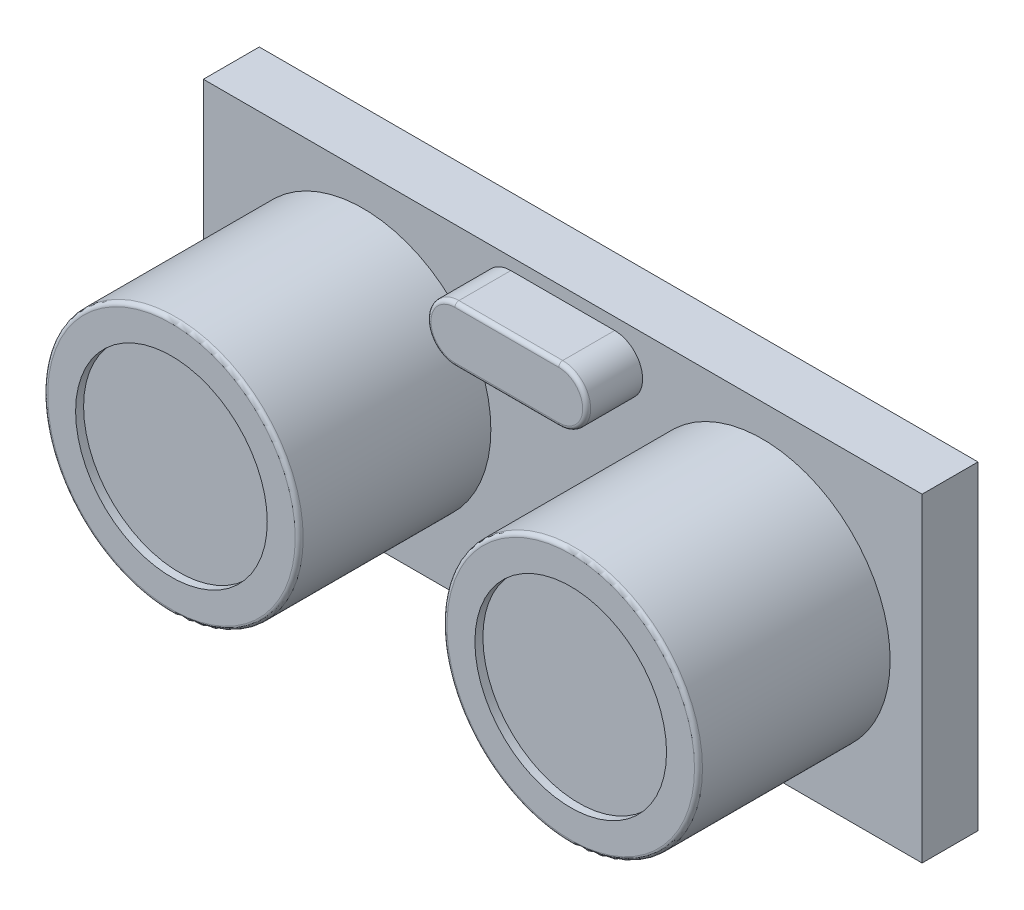
from build123d import *

# Parameters (mm, degrees)
SKETCH1_W           = 45
SKETCH1_H           = 20
BOSS_EXTRUDE1_DEPTH = 3.5
SKETCH2_R           = 8
BOSS_EXTRUDE2_DEPTH = 12
SKETCH3_R           = 6
CUT_EXTRUDE1_DEPTH  = 0.5
FILLET1_R           = 0.25
BOSS_EXTRUDE3_DEPTH = 3.5
FILLET2_R           = 0.25


with BuildPart() as part:
    # Sketch1 → Boss-Extrude1 (new body)
    with BuildSketch(Plane.XY):
        Rectangle(SKETCH1_W, SKETCH1_H)
    extrude(amount=BOSS_EXTRUDE1_DEPTH)

    # Sketch2 → Boss-Extrude2 (add)
    with BuildSketch(Plane.XY.offset(3.5)):
        with Locations((12.5, 0)):
            Circle(SKETCH2_R)
        with Locations((-12.5, 0)):
            Circle(SKETCH2_R)
    extrude(amount=BOSS_EXTRUDE2_DEPTH)

    # Sketch3 → Cut-Extrude1 (cut)
    with BuildSketch(Plane.XY.offset(15.5)):
        with Locations((-12.5, 0)):
            Circle(SKETCH3_R)
        with Locations((12.5, 0)):
            Circle(SKETCH3_R)
    extrude(amount=-CUT_EXTRUDE1_DEPTH, mode=Mode.SUBTRACT)

    # Fillet1
    fillet1_edges = [part.edges().sort_by_distance(p)[0] for p in [
        (4.5, 0, 15.5),
        (-20.5, 0, 15.5),
    ]]
    fillet(fillet1_edges, radius=FILLET1_R)

    # Sketch4 → Boss-Extrude3 (add)
    with BuildSketch(Plane.XY.offset(3.5)):
        with BuildLine():
            Line((-3.25, 9.25), (3.25, 9.25))
            ThreePointArc((3.25, 9.25), (5, 7.5), (3.25, 5.75))
            Line((3.25, 5.75), (-3.25, 5.75))
            ThreePointArc((-3.25, 5.75), (-5, 7.5), (-3.25, 9.25))
        make_face()
    extrude(amount=BOSS_EXTRUDE3_DEPTH)

    # Fillet2
    fillet2_edges = [part.edges().sort_by_distance(p)[0] for p in [
        (-5, 7.5, 7),
        (0, 5.75, 7),
        (5, 7.5, 7),
        (0, 9.25, 7),
    ]]
    fillet(fillet2_edges, radius=FILLET2_R)


solid = part.part
